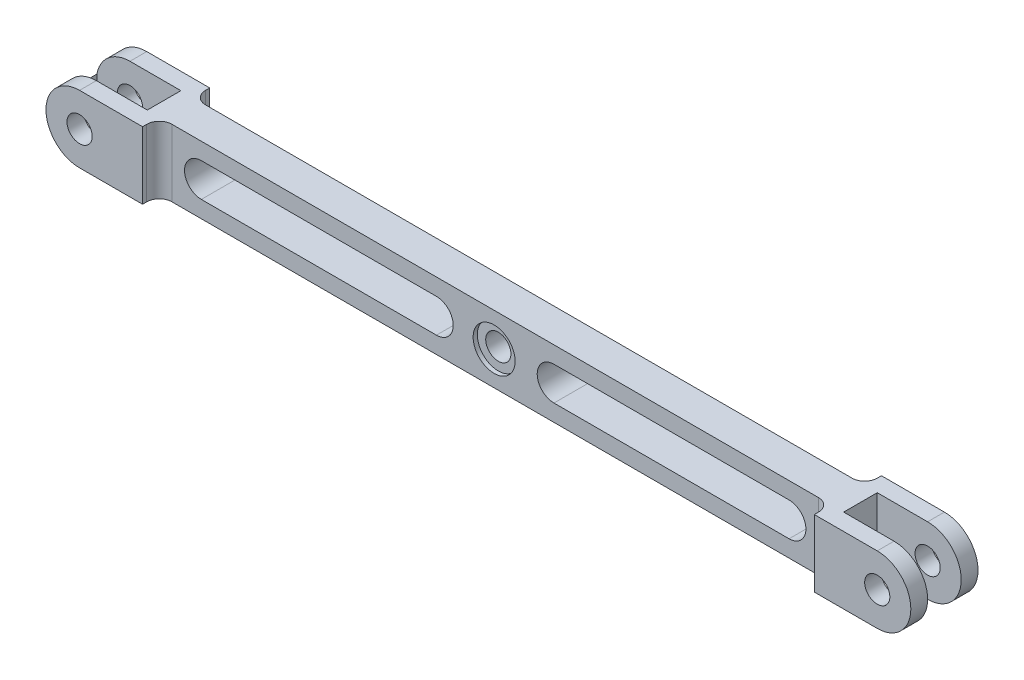
from build123d import *

# Parameters (mm, degrees)
SKETCH1_R           = 3
SKETCH1_R_2         = 5
BOSS_EXTRUDE1_DEPTH = 8
SKETCH1_4_R         = 5
SKETCH1_4_R_2       = 3
BOSS_EXTRUDE2_DEPTH = 3
SKETCH2_W           = 20
SKETCH2_H           = 8
CUT_EXTRUDE2_DEPTH  = 105.537509551


with BuildPart() as part:
    # Sketch1 → Boss-Extrude1 (new, symmetric)
    with BuildSketch(Plane.XY):
        with BuildLine():
            ThreePointArc((94.995586814, -8), (102.995586814, 0), (94.995586814, 8))
            Line((94.995586814, 8), (-94.995586814, 8))
            ThreePointArc((-94.995586814, 8), (-102.995586814, 0), (-94.995586814, -8))
            Line((-94.995586814, -8), (94.995586814, -8))
        make_face()
        with Locations((-94.995586814, 0)):
            Circle(SKETCH1_R, mode=Mode.SUBTRACT)
        with Locations((-0.258516261, -0.020052265)):
            Circle(SKETCH1_R_2, mode=Mode.SUBTRACT)
        with BuildLine():
            ThreePointArc((-70, -4), (-74, 0), (-70, 4))
            Line((-70, 4), (-14, 4))
            ThreePointArc((-14, 4), (-10, 0), (-14, -4))
            Line((-14, -4), (-70, -4))
        make_face(mode=Mode.SUBTRACT)
        with BuildLine():
            ThreePointArc((14, -4), (10, 0), (14, 4))
            Line((14, 4), (70, 4))
            ThreePointArc((70, 4), (74, 0), (70, -4))
            Line((70, -4), (14, -4))
        make_face(mode=Mode.SUBTRACT)
        with Locations((94.995586814, 0)):
            Circle(SKETCH1_R, mode=Mode.SUBTRACT)
    extrude(amount=BOSS_EXTRUDE1_DEPTH, both=True)

    # Sketch1<4> → Boss-Extrude2 (add, symmetric)
    with BuildSketch(Plane.XY):
        with Locations((-0.258516261, -0.020052265)):
            Circle(SKETCH1_4_R)
        with Locations((-0.258516261, -0.020052265)):
            Circle(SKETCH1_4_R_2, mode=Mode.SUBTRACT)
    extrude(amount=BOSS_EXTRUDE2_DEPTH, both=True)

    # Sketch2 → Cut-Extrude2 (cut, through all)
    with BuildSketch(Plane(origin=(0, 8, 0), x_dir=(1, 0, 0), z_dir=(0, 1, 0))):
        with BuildLine():
            Line((-80, 8), (80, 8))
            Line((80, 8), (80, 7))
            ThreePointArc((80, 7), (79.121320344, 4.878679656), (77, 4))
            Line((77, 4), (-77, 4))
            ThreePointArc((-77, 4), (-79.121320344, 4.878679656), (-80, 7))
            Line((-80, 7), (-80, 8))
        make_face()
        with BuildLine():
            Line((80, -8), (-80, -8))
            Line((-80, -8), (-80, -7))
            ThreePointArc((-80, -7), (-79.121320344, -4.878679656), (-77, -4))
            Line((-77, -4), (77, -4))
            ThreePointArc((77, -4), (79.121320344, -4.878679656), (80, -7))
            Line((80, -7), (80, -8))
        make_face()
        with Locations((-92.866692646, 0)):
            Rectangle(SKETCH2_W, SKETCH2_H)
        with Locations((92.995586814, 0)):
            Rectangle(SKETCH2_W, SKETCH2_H)
    extrude(amount=-CUT_EXTRUDE2_DEPTH, mode=Mode.SUBTRACT)


solid = part.part
